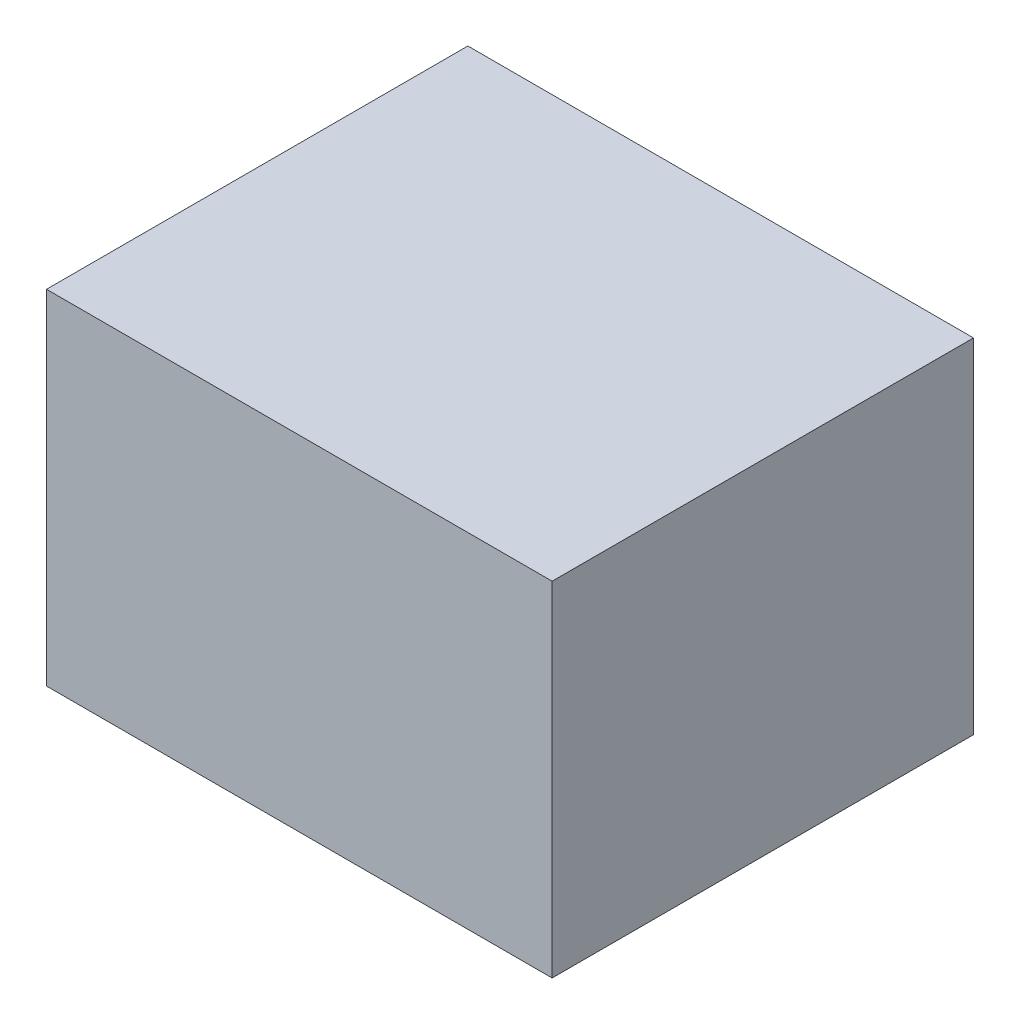
from build123d import *

# Parameters (mm, degrees)
SKETCH1_W           = 72.39
SKETCH1_H           = 49.1998
BOSS_EXTRUDE1_DEPTH = 60.325


with BuildPart() as part:
    # Sketch1 → Boss-Extrude1 (new body)
    with BuildSketch(Plane.XY):
        with Locations((36.195, 24.5999)):
            Rectangle(SKETCH1_W, SKETCH1_H)
    extrude(amount=BOSS_EXTRUDE1_DEPTH)


solid = part.part
